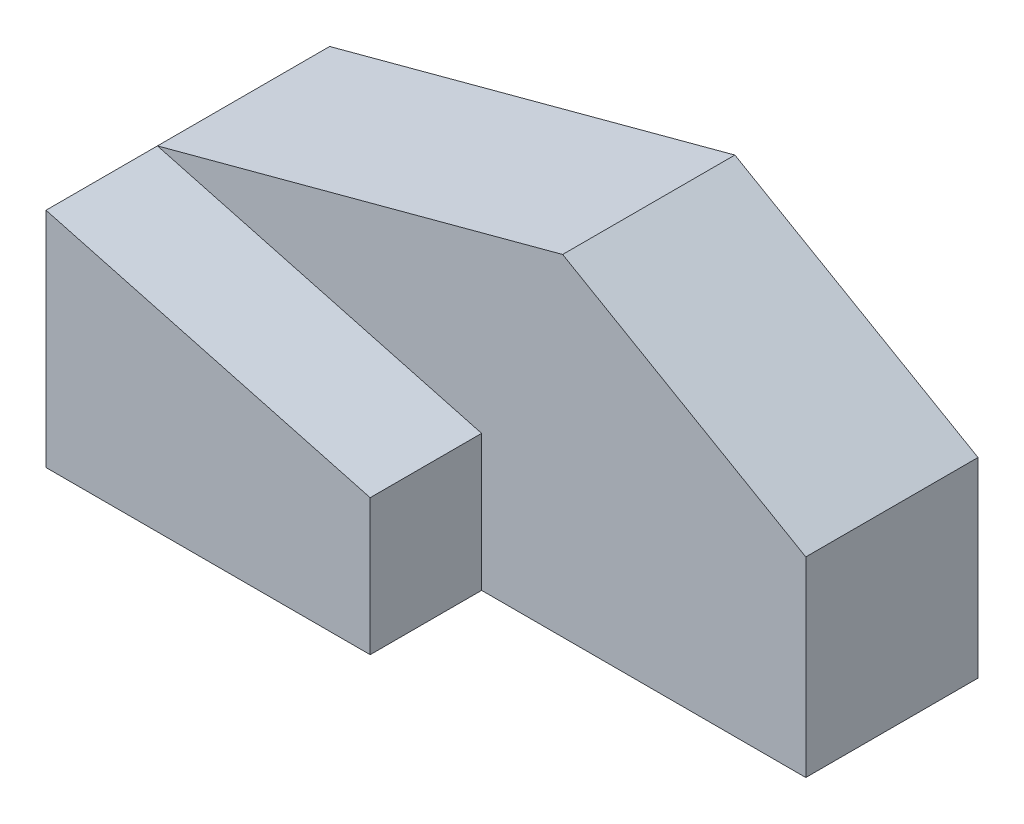
from build123d import *

# Parameters (mm, degrees)
EXTRUDE_3_DEPTH = 17
EXTRUDE_4_DEPTH = 11


with BuildPart() as part:
    # 草圖3 → 填料-伸長3 (new body)
    with BuildSketch(Plane.XY):
        Polygon((0, 0), (64, 0), (64, 18.861561237), (40, 32.717967697), (0, 22), align=None)
    extrude(amount=-EXTRUDE_3_DEPTH)

    # 草圖4 → 填料-伸長4 (add)
    with BuildSketch(Plane.XY):
        Polygon((0, 0), (32, 0), (32, 13.425625842), (0, 22), align=None)
    extrude(amount=EXTRUDE_4_DEPTH)


solid = part.part
